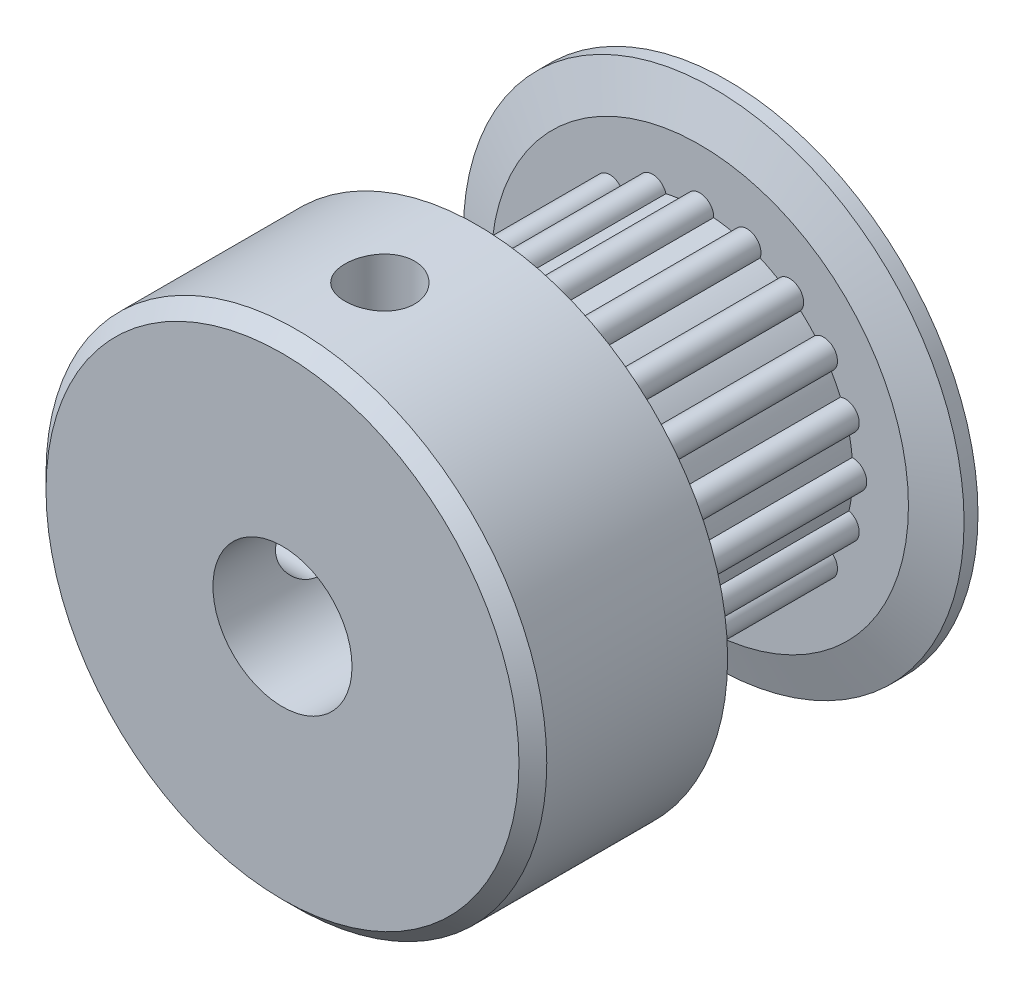
from build123d import *

# Parameters (mm, degrees)
M3X0_5_TAPPED_HOLE1_REACH           = 25.691
M3X0_5_TAPPED_HOLE1_BORE_R          = 1.25
M3X0_5_TAPPED_HOLE1_ON_FACE_2_REACH = 25.691
M3X0_5_TAPPED_HOLE1_BORE_2_R        = 1.25
CHAMFER1_SIZE                       = 0.5
BOSS_EXTRUDE1_START                 = 7.5
BOSS_EXTRUDE1_DEPTH                 = 7.5
CIRPATTERN1_COUNT                   = 20


with BuildPart() as part:
    # Sketch1 → Revolve1 (revolve)
    with BuildSketch(Plane(origin=(0, 0, 0), x_dir=(0, 0, -1), z_dir=(1, 0, 0)), mode=Mode.PRIVATE) as revolve1_sk:
        Polygon((-3.75, 7.5), (-3.75, 5.5), (3.75, 5.5), (3.75, 7.5), (4.25, 9), (4.75, 9), (4.75, 2.5), (-11.25, 2.5), (-11.25, 9), (-4.25, 9), align=None)
    revolve(revolve1_sk.sketch.rotate(Axis((0, 0, 0), (0, 0, -1)), 90), axis=Axis((0, 0, 0), (0, 0, -1)))

    # M3x0.5 Tapped Hole1 bore (on position points) → M3x0.5 Tapped Hole1 (cut, up to next)
    with BuildSketch(Plane(origin=(-9, 0, 7.75), x_dir=(0, -1, 0), z_dir=(-1, 0, 0)), mode=Mode.PRIVATE) as m3x0_5_tapped_hole1_sk1:
        Circle(M3X0_5_TAPPED_HOLE1_BORE_R)
    m3x0_5_tapped_hole1_tool1 = extrude(m3x0_5_tapped_hole1_sk1.sketch, amount=-M3X0_5_TAPPED_HOLE1_REACH, mode=Mode.PRIVATE) & part.part
    add(m3x0_5_tapped_hole1_tool1.solids().sort_by_distance((-9, 0, 7.75))[0], mode=Mode.SUBTRACT)

    # M3x0.5 Tapped Hole1 bore 2 (on position points) → M3x0.5 Tapped Hole1 on face 2 (cut, up to next)
    with BuildSketch(Plane(origin=(0, 9, 7.75), x_dir=(0, 0, 1), z_dir=(0, 1, 0)), mode=Mode.PRIVATE) as m3x0_5_tapped_hole1_on_face_2_sk1:
        Circle(M3X0_5_TAPPED_HOLE1_BORE_2_R)
    m3x0_5_tapped_hole1_on_face_2_tool1 = extrude(m3x0_5_tapped_hole1_on_face_2_sk1.sketch, amount=-M3X0_5_TAPPED_HOLE1_ON_FACE_2_REACH, mode=Mode.PRIVATE) & part.part
    add(m3x0_5_tapped_hole1_on_face_2_tool1.solids().sort_by_distance((0, 9, 7.75))[0], mode=Mode.SUBTRACT)

    # Chamfer1
    chamfer1_edges = [part.edges().sort_by_distance(p)[0] for p in [
        (-9, 0, 11.25),
    ]]
    chamfer(chamfer1_edges, length=CHAMFER1_SIZE)

    # Sketch4 → Boss-Extrude1 (add)
    with BuildSketch(Plane(origin=(0, 0, 3.75), x_dir=(-1, 0, 0), z_dir=(0, 0, -1)).offset(BOSS_EXTRUDE1_START)):
        with BuildLine():
            ThreePointArc((-0.499483204, 5.477272727), (0, 6), (0.499483204, 5.477272727))
            ThreePointArc((0.499483204, 5.477272727), (0, 5.5), (-0.499483204, 5.477272727))
        make_face()
    boss_extrude1 = extrude(amount=-BOSS_EXTRUDE1_DEPTH)

    # CirPattern1: Boss-Extrude1 ×20 about axis
    cirpattern1_axis = Axis((0, 0, 0), (0, 0, 1))
    for i in range(1, CIRPATTERN1_COUNT):
        add(boss_extrude1.rotate(cirpattern1_axis, i * 360 / CIRPATTERN1_COUNT))


solid = part.part
